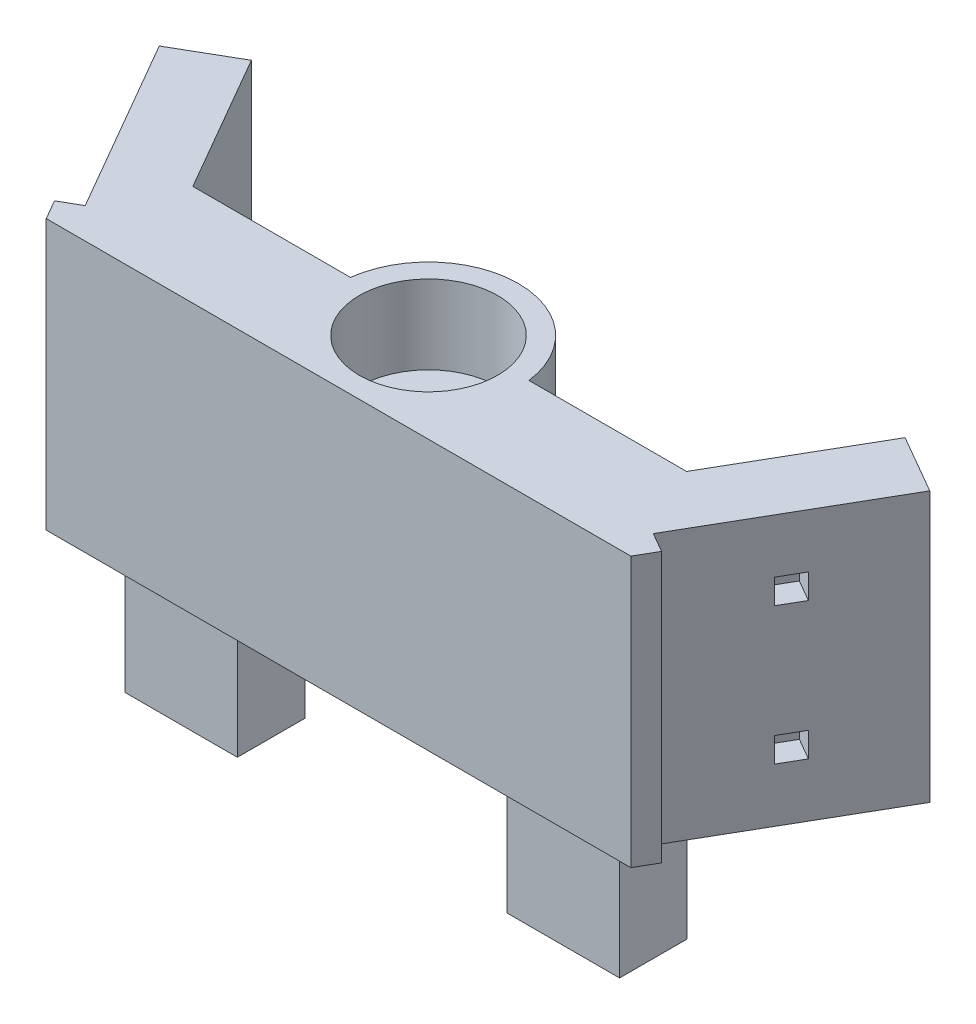
from build123d import *

# Parameters (mm, degrees)
BOSS_EXTRUDE1_DEPTH            = 12
F_2_5_2_5_DIAMETER_HOLE1_D     = 2.5
F_2_5_2_5_DIAMETER_HOLE1_DEPTH = 10
F_2_5_2_5_DIAMETER_HOLE1_TIP   = 0.751075774
SKETCH4_R                      = 3.0762
CUT_EXTRUDE1_DEPTH             = 3.5
SKETCH5_W                      = 5
SKETCH5_H                      = 3
BOSS_EXTRUDE2_DEPTH            = 6
SKETCH7_W                      = 1.1
SKETCH7_H                      = 1.1
CUT_EXTRUDE3_DEPTH             = 1.1
SKETCH8_W                      = 1.1
SKETCH8_H                      = 1.1
CUT_EXTRUDE4_DEPTH             = 1.1


with BuildPart() as part:
    # Sketch1 → Boss-Extrude1 (new body)
    with BuildSketch(Plane(origin=(0, 0, 0), x_dir=(1, 0, 0), z_dir=(0, 1, 0))):
        with BuildLine():
            Line((-13, -4), (13, -4))
            Line((13, -4), (13.5, -3.133974596))
            Line((13.5, -3.133974596), (12.633974596, -2.633974596))
            Line((12.633974596, -2.633974596), (17.133974596, 5.160254038))
            Line((17.133974596, 5.160254038), (14.535898385, 6.660254038))
            Line((14.535898385, 6.660254038), (10.979274058, 0.5))
            Line((10.979274058, 0.5), (3.968626967, 0.5))
            ThreePointArc((3.968626967, 0.5), (0, 4), (-3.968626967, 0.5))
            Line((-3.968626967, 0.5), (-10.979274058, 0.5))
            Line((-10.979274058, 0.5), (-14.535898385, 6.660254038))
            Line((-14.535898385, 6.660254038), (-17.133974596, 5.160254038))
            Line((-17.133974596, 5.160254038), (-12.633974596, -2.633974596))
            Line((-12.633974596, -2.633974596), (-13.5, -3.133974596))
            Line((-13.5, -3.133974596), (-13, -4))
        make_face()
    extrude(amount=BOSS_EXTRUDE1_DEPTH)

    # Ø2.5 (2.5) Diameter Hole1
    with Locations(Plane(origin=(0, 12, 0), x_dir=(1, 0, 0), z_dir=(0, 1, 0))):
        with Locations((0, 0)):
            Hole(F_2_5_2_5_DIAMETER_HOLE1_D / 2, depth=F_2_5_2_5_DIAMETER_HOLE1_DEPTH)
            with Locations((0, 0, -(F_2_5_2_5_DIAMETER_HOLE1_DEPTH + F_2_5_2_5_DIAMETER_HOLE1_TIP / 2))):  # 118° drill point
                Cone(0, F_2_5_2_5_DIAMETER_HOLE1_D / 2, F_2_5_2_5_DIAMETER_HOLE1_TIP, mode=Mode.SUBTRACT)

    # Sketch4 → Cut-Extrude1 (cut)
    with BuildSketch(Plane(origin=(0, 12, 0), x_dir=(1, 0, 0), z_dir=(0, 1, 0))):
        with Locations(Location((0, 0, 0), (0, 0, 270))):
            Circle(SKETCH4_R)
    extrude(amount=-CUT_EXTRUDE1_DEPTH, mode=Mode.SUBTRACT)

    # Sketch5 → Boss-Extrude2 (add)
    with BuildSketch(Plane.XZ):
        with Locations((8.5, 1)):
            Rectangle(SKETCH5_W, SKETCH5_H)
        with Locations((-8.5, 1)):
            Rectangle(SKETCH5_W, SKETCH5_H)
    extrude(amount=BOSS_EXTRUDE2_DEPTH)

    # Sketch7 → Cut-Extrude3 (cut)
    with BuildSketch(Plane(origin=(-10.616025404, 0, 6.129165125), x_dir=(0.49999999999999906, 0, 0.8660254037844393), z_dir=(-0.8660254037844392, 0, 0.499999999999999))):
        with Locations((-8.535898385, 9.05)):
            Rectangle(SKETCH7_W, SKETCH7_H)
        with Locations((-8.535898385, 2.95)):
            Rectangle(SKETCH7_W, SKETCH7_H)
    extrude(amount=-CUT_EXTRUDE3_DEPTH, mode=Mode.SUBTRACT)

    # Sketch8 → Cut-Extrude4 (cut)
    with BuildSketch(Plane(origin=(10.616025404, 0, 6.129165125), x_dir=(0.4999999999999978, 0, -0.86602540378444), z_dir=(0.86602540378444, 0, 0.4999999999999978))):
        with Locations((8.535898385, 9.05)):
            Rectangle(SKETCH8_W, SKETCH8_H)
        with Locations((8.535898385, 2.95)):
            Rectangle(SKETCH8_W, SKETCH8_H)
    extrude(amount=-CUT_EXTRUDE4_DEPTH, mode=Mode.SUBTRACT)


solid = part.part
